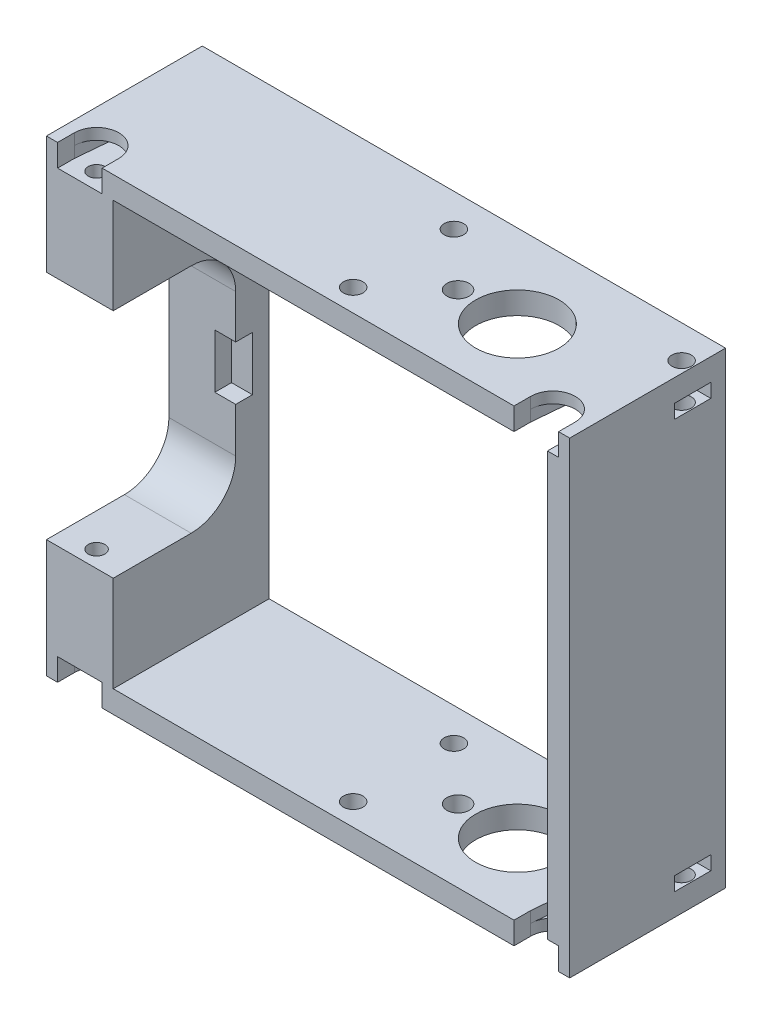
from build123d import *

# Parameters (mm, degrees)
SALIENTE_EXTRUIR1_DEPTH      = 4
SALIENTE_EXTRUIR1_DEPTH_BACK = 24
CROQUIS1_W                   = 94
CROQUIS1_H                   = 84
CROQUIS1_W_2                 = 78
CROQUIS1_H_2                 = 76
CROQUIS10_R                  = 1.5
CORTAR_EXTRUIR6_DEPTH        = 109.830188826
CORTAR_EXTRUIR1_DEPTH        = 2
CORTAR_EXTRUIR5_DEPTH        = 2
CORTAR_EXTRUIR2_REACH        = 122.073
CROQUIS12_R                  = 7.5
CROQUIS12_R_2                = 1.75
CROQUIS12_R_3                = 2
CORTAR_EXTRUIR7_DEPTH        = 10
CROQUIS17_W                  = 4
CROQUIS17_H                  = 9.7
CORTAR_EXTRUIR10_DEPTH       = 3
CORTAR_EXTRUIR11_DEPTH       = 2.5
SIMETR_A2_COPY_1_DEPTH       = 2
SIMETR_A2_COPY_2_DEPTH       = 2


with BuildPart() as part:
    # Croquis1 → Saliente-Extruir1 (new, two sides: drawn at the far end of the back side and taken through both)
    with BuildSketch(Plane.XY.offset(-SALIENTE_EXTRUIR1_DEPTH_BACK)):
        with Locations((-17.9, 28.75)):
            Rectangle(CROQUIS1_W, CROQUIS1_H)
        with Locations((-13.9, 28.75)):
            Rectangle(CROQUIS1_W_2, CROQUIS1_H_2, mode=Mode.SUBTRACT)
    extrude(amount=SALIENTE_EXTRUIR1_DEPTH + SALIENTE_EXTRUIR1_DEPTH_BACK)

    # Croquis10 → Cortar-Extruir6 (cut, through all)
    with BuildSketch(Plane(origin=(0, 70.75, 0), x_dir=(1, 0, 0), z_dir=(0, 1, 0))):
        with Locations((-58.9, -1)):
            Circle(CROQUIS10_R)
    extrude(amount=-CORTAR_EXTRUIR6_DEPTH, mode=Mode.SUBTRACT)

    # Croquis2 → Cortar-Extruir1 (cut)
    with BuildSketch(Plane(origin=(0, -13.25, 0), x_dir=(-1, 0, 0), z_dir=(0, -1, 0))):
        with BuildLine():
            Line((54.9, -1), (54.9, -4))
            Line((54.9, -4), (62.9, -4))
            Line((62.9, -4), (62.9, -1))
            ThreePointArc((62.9, -1), (58.9, 3), (54.9, -1))
        make_face()
    cortar_extruir1 = extrude(amount=-CORTAR_EXTRUIR1_DEPTH, mode=Mode.SUBTRACT)

    # Croquis9 → Cortar-Extruir5 (cut)
    with BuildSketch(Plane(origin=(0, -9.25, 0), x_dir=(1, 0, 0), z_dir=(0, 1, 0))):
        with BuildLine():
            Line((-61.389870926, 15.724817194), (-62.9, -1))
            Line((-62.9, -1), (-62.9, -4))
            Line((-62.9, -4), (-54.9, -4))
            Line((-54.9, -4), (-54.9, -1))
            Line((-54.9, -1), (-56.410129074, 15.724817194))
            ThreePointArc((-56.410129074, 15.724817194), (-58.9, 18), (-61.389870926, 15.724817194))
        make_face()
    cortar_extruir5 = extrude(amount=-CORTAR_EXTRUIR5_DEPTH, mode=Mode.SUBTRACT)

    # Croquis5 → Cortar-Extruir2 (cut, up to next)
    with BuildSketch(Plane.ZY.offset(64.9), mode=Mode.PRIVATE) as cortar_extruir2_sk1:
        with BuildLine():
            Line((-18, 41.55), (-18, 15.95))
            ThreePointArc((-18, 15.95), (-15.656854249, 10.293145751), (-10, 7.95))
            Line((-10, 7.95), (4, 7.95))
            Line((4, 7.95), (4, 49.55))
            Line((4, 49.55), (-10, 49.55))
            ThreePointArc((-10, 49.55), (-15.656854249, 47.206854249), (-18, 41.55))
        make_face()
    cortar_extruir2_tool1 = extrude(cortar_extruir2_sk1.sketch, amount=-CORTAR_EXTRUIR2_REACH, mode=Mode.PRIVATE) & part.part
    add(cortar_extruir2_tool1.solids().sort_by_distance((-64.9, 28.75, -6.714921))[0], mode=Mode.SUBTRACT)

    # Croquis12 → Cortar-Extruir7 (cut)
    with BuildSketch(Plane.XZ.offset(13.25)):
        with Locations((6.65, -9.05)):
            Circle(CROQUIS12_R)
        with Locations((-13.8, 0)):
            Circle(CROQUIS12_R_2)
        with Locations((-13.8, -18.1)):
            Circle(CROQUIS12_R_2)
        with Locations((-4, -9.05)):
            Circle(CROQUIS12_R_3)
        with Locations((27.1, -18.1)):
            Circle(CROQUIS12_R_2)
    cortar_extruir7 = extrude(amount=-CORTAR_EXTRUIR7_DEPTH, mode=Mode.SUBTRACT)

    # Croquis17 → Cortar-Extruir10 (cut)
    with BuildSketch(Plane.XY.offset(-18)):
        with Locations((-54.655566502, 28.846197779)):
            Rectangle(CROQUIS17_W, CROQUIS17_H)
    extrude(amount=-CORTAR_EXTRUIR10_DEPTH, mode=Mode.SUBTRACT)

    # Croquis20 → Cortar-Extruir11 (cut)
    with BuildSketch(Plane(origin=(0, -9.25, 0), x_dir=(-1, 0, 0), z_dir=(0, -1, 0))):
        Polygon((-29.1, 14.85), (-27.1, 14.85), (-25.223611625, 14.85), (-24.285417438, 16.475), (-23.34722325, 18.1), (-24.285417438, 19.725), (-25.223611625, 21.35), (-27.1, 21.35), (-29.1, 21.35), align=None)
    cortar_extruir11 = extrude(amount=-CORTAR_EXTRUIR11_DEPTH, mode=Mode.SUBTRACT)

    # Simetría3: Cortar-Extruir1, Cortar-Extruir5 across plane
    add(cortar_extruir1.mirror(Plane.ZY.offset(17.9)), mode=Mode.SUBTRACT)
    add(cortar_extruir5.mirror(Plane.ZY.offset(17.9)), mode=Mode.SUBTRACT)

    # Simetría2: Cortar-Extruir1, Cortar-Extruir5, Cortar-Extruir7, Cortar-Extruir11 across plane
    add(cortar_extruir1.mirror(Plane(origin=(0, 28.75, 0), x_dir=(0, 0, 1), z_dir=(0, -1, 0))), mode=Mode.SUBTRACT)
    add(cortar_extruir5.mirror(Plane(origin=(0, 28.75, 0), x_dir=(0, 0, 1), z_dir=(0, -1, 0))), mode=Mode.SUBTRACT)
    add(cortar_extruir7.mirror(Plane(origin=(0, 28.75, 0), x_dir=(0, 0, 1), z_dir=(0, -1, 0))), mode=Mode.SUBTRACT)
    add(cortar_extruir11.mirror(Plane(origin=(0, 28.75, 0), x_dir=(0, 0, 1), z_dir=(0, -1, 0))), mode=Mode.SUBTRACT)

    # Simetría2 copy 1 sketch → Simetría2 copy 1 (cut)
    with BuildSketch(Plane(origin=(-35.8, 70.75, 0), x_dir=(1, 0, 0), z_dir=(0, 1, 0))):
        with BuildLine():
            Line((54.9, -1), (54.9, -4))
            Line((54.9, -4), (62.9, -4))
            Line((62.9, -4), (62.9, -1))
            ThreePointArc((62.9, -1), (58.9, 3), (54.9, -1))
        make_face()
    extrude(amount=-SIMETR_A2_COPY_1_DEPTH, mode=Mode.SUBTRACT)

    # Simetría2 copy 2 sketch → Simetría2 copy 2 (cut)
    with BuildSketch(Plane(origin=(-35.8, 66.75, 0), x_dir=(-1, 0, 0), z_dir=(0, -1, 0))):
        with BuildLine():
            Line((-61.389870926, 15.724817194), (-62.9, -1))
            Line((-62.9, -1), (-62.9, -4))
            Line((-62.9, -4), (-54.9, -4))
            Line((-54.9, -4), (-54.9, -1))
            Line((-54.9, -1), (-56.410129074, 15.724817194))
            ThreePointArc((-56.410129074, 15.724817194), (-58.9, 18), (-61.389870926, 15.724817194))
        make_face()
    extrude(amount=-SIMETR_A2_COPY_2_DEPTH, mode=Mode.SUBTRACT)


solid = part.part
